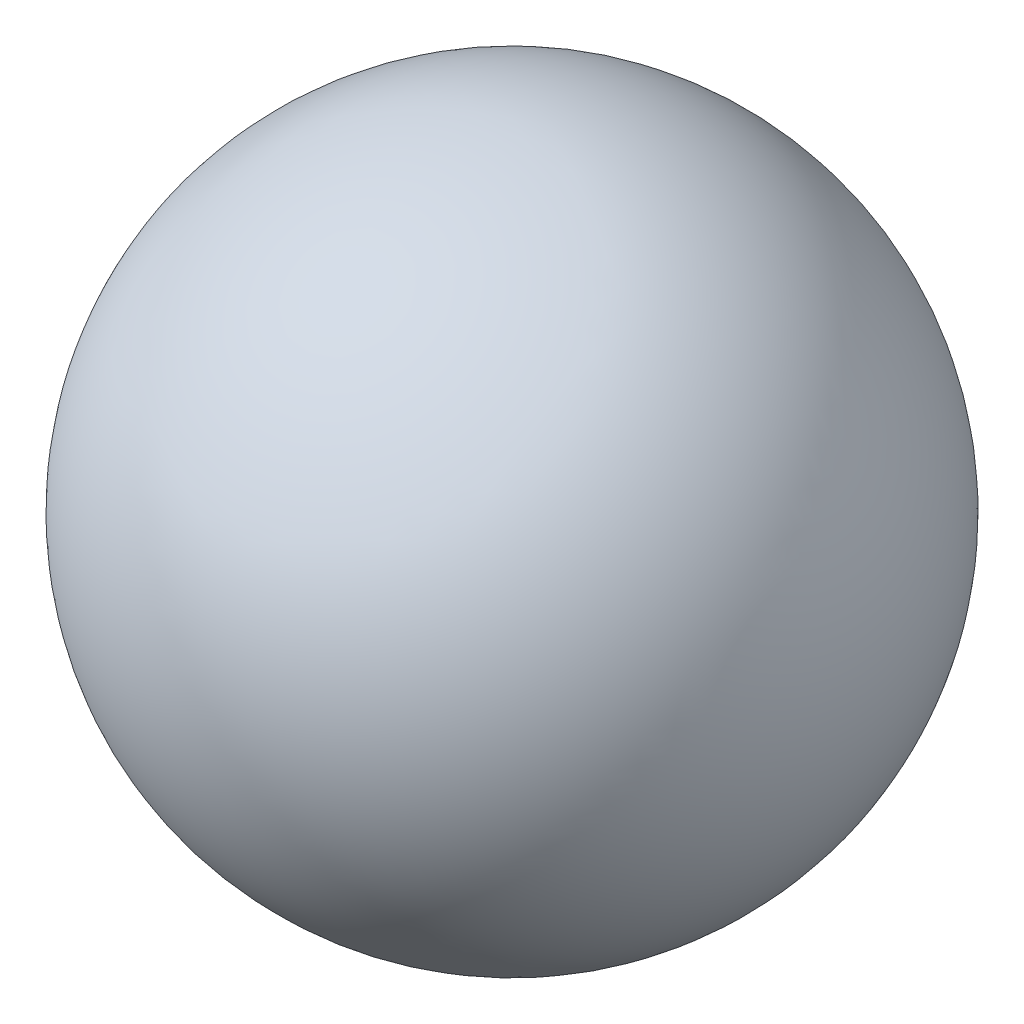
from build123d import *


with BuildPart() as part:
    # Sketch1 → Revolve5 (revolve)
    with BuildSketch(Plane(origin=(0, 0, 0), x_dir=(1, 0, 0), z_dir=(0, 1, 0))):
        with BuildLine():
            Line((-210348.45, 0), (210348.45, 0))
            ThreePointArc((210348.45, 0), (0, -210348.45), (-210348.45, 0))
        make_face()
    revolve(axis=Axis((-210348.45, 0, 0), (1, 0, 0)))


solid = part.part
